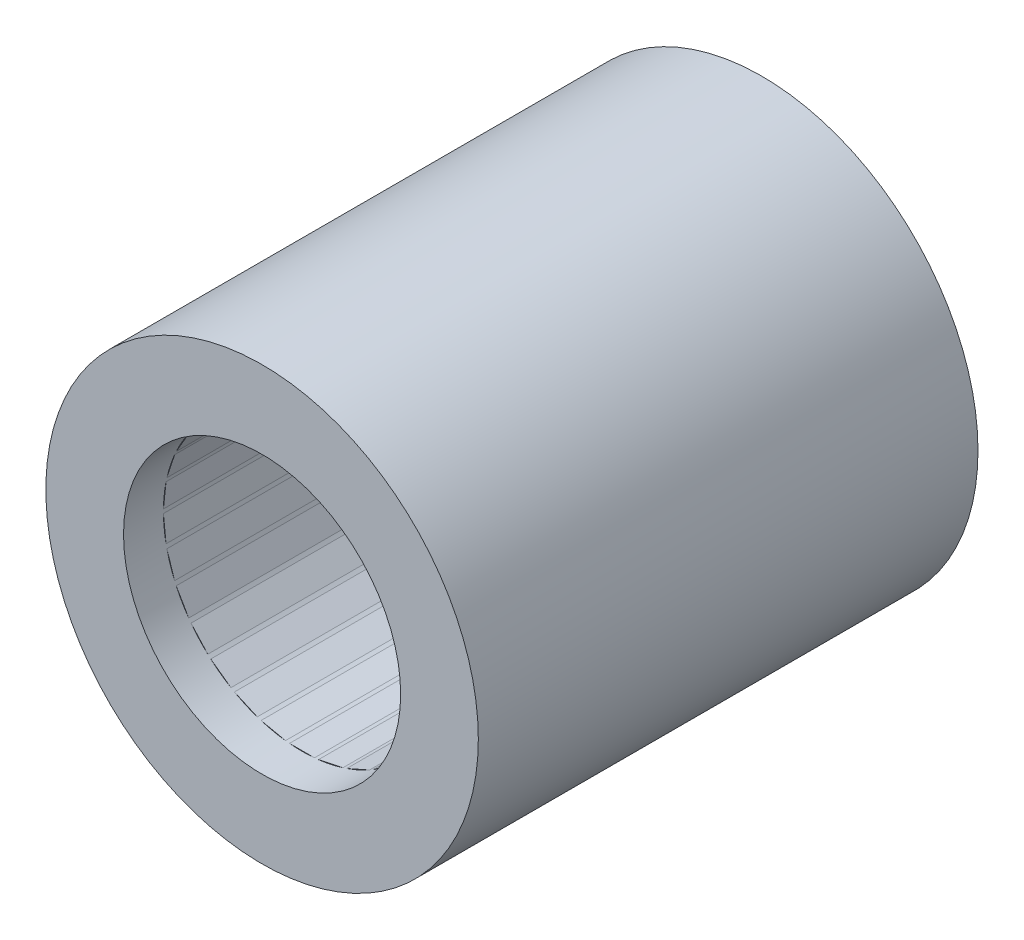
from build123d import *

# Parameters (mm, degrees)
SKETCH1_R           = 51.5
SKETCH1_R_2         = 33
BOSS_EXTRUDE1_DEPTH = 59.5
SKETCH2_W           = 5.951131742
SKETCH2_H           = 4.923958597
BOSS_EXTRUDE2_DEPTH = 50
CIRPATTERN1_COUNT   = 30


with BuildPart() as part:
    # Sketch1 → Boss-Extrude1 (new, symmetric)
    with BuildSketch(Plane.XY):
        Circle(SKETCH1_R)
        Circle(SKETCH1_R_2, mode=Mode.SUBTRACT)
    extrude(amount=BOSS_EXTRUDE1_DEPTH, both=True)

    # Sketch2 → Boss-Extrude2 (add, symmetric)
    with BuildSketch(Plane.XY):
        with Locations((0, -35.327554111)):
            Rectangle(SKETCH2_W, SKETCH2_H)
    boss_extrude2 = extrude(amount=BOSS_EXTRUDE2_DEPTH, both=True)

    # CirPattern1: Boss-Extrude2 ×30 about axis
    cirpattern1_axis = Axis((0, 0, 0), (0, 0, 1))
    for i in range(1, CIRPATTERN1_COUNT):
        add(boss_extrude2.rotate(cirpattern1_axis, i * 360 / CIRPATTERN1_COUNT))


solid = part.part
